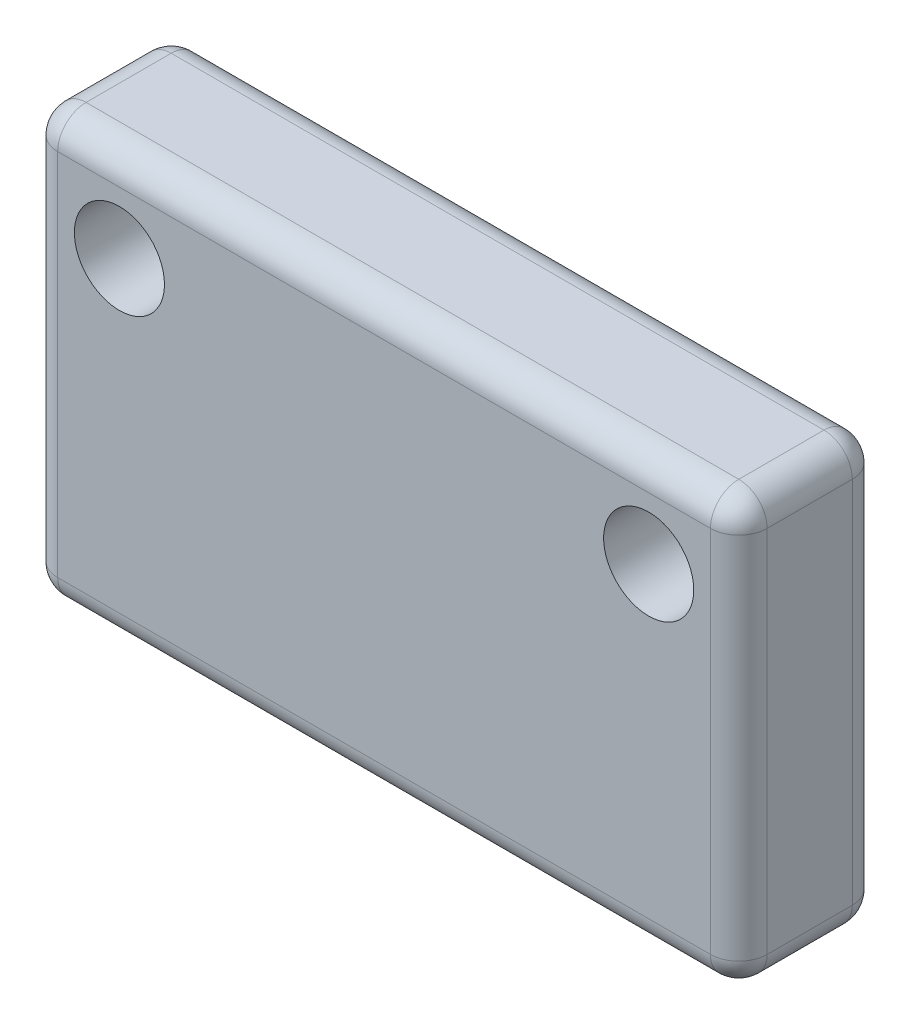
from build123d import *

# Parameters (mm, degrees)
ESBO_O1_W                = 25
ESBO_O1_H                = 15
RESSALTO_EXTRUS_O1_DEPTH = 5
ESBO_O2_R                = 1.5875
CORTE_EXTRUS_O1_DEPTH    = 16.411035007
FILETE2_R                = 1


with BuildPart() as part:
    # Esboço1 → Ressalto-extrusão1 (new body)
    with BuildSketch(Plane.XY):
        Rectangle(ESBO_O1_W, ESBO_O1_H)
    extrude(amount=RESSALTO_EXTRUS_O1_DEPTH)

    # Esboço2 → Corte-extrusão1 (cut, through all)
    with BuildSketch(Plane.XY.offset(5)):
        with Locations((-9.325, 4.325)):
            Circle(ESBO_O2_R)
        with Locations((9.325, 4.325)):
            Circle(ESBO_O2_R)
    extrude(amount=-CORTE_EXTRUS_O1_DEPTH, mode=Mode.SUBTRACT)

    # Filete2
    filete2_edges = [part.edges().sort_by_distance(p)[0] for p in [
        (12.5, 0, 5),
        (0, 7.5, 5),
        (-12.5, 0, 5),
        (0, 7.5, 0),
        (12.5, 0, 0),
        (0, -7.5, 0),
        (-12.5, 0, 0),
        (0, -7.5, 5),
        (-12.5, 7.5, 2.5),
        (12.5, 7.5, 2.5),
        (12.5, -7.5, 2.5),
        (-12.5, -7.5, 2.5),
    ]]
    fillet(filete2_edges, radius=FILETE2_R)


solid = part.part
